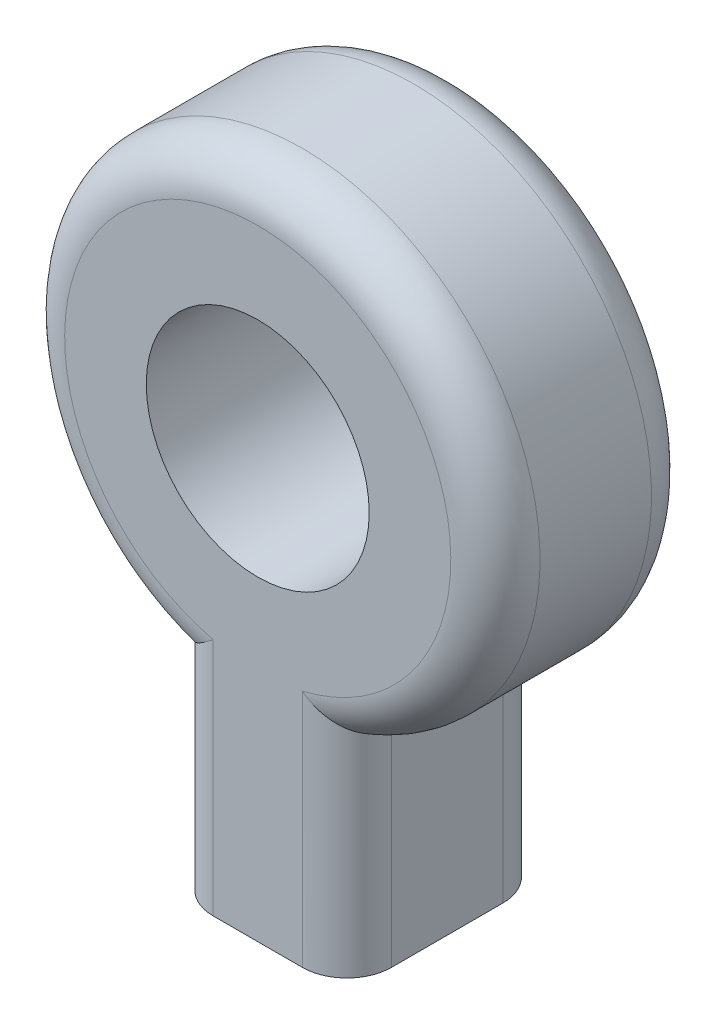
from build123d import *

# Parameters (mm, degrees)
SKETCH1_R           = 5
BOSS_EXTRUDE1_DEPTH = 9
FILLET1_R           = 2
SKETCH2_R           = 3
CUT_EXTRUDE2_DEPTH  = 9


with BuildPart() as part:
    # Sketch1 → Boss-Extrude1 (new body)
    with BuildSketch(Plane.XY):
        with BuildLine():
            Line((-3.996251998, 18.882233703), (-3.996251998, 9.603351185))
            Line((-3.996251998, 9.603351185), (0, 9.603351185))
            Line((0, 9.603351185), (4, 9.603351185))
            Line((4, 9.603351185), (4, 18.883750084))
            ThreePointArc((4, 18.883750084), (-0.002021567, 39.425278988), (-3.996251998, 18.882233703))
        make_face()
        with Locations((0, 28.765059691)):
            Circle(SKETCH1_R, mode=Mode.SUBTRACT)
    extrude(amount=BOSS_EXTRUDE1_DEPTH)

    # Fillet1
    fillet1_edges = [part.edges().sort_by_distance(p)[0] for p in [
        (-0.002021567, 39.425278988, 9),
        (-3.996251998, 14.242792444, 9),
        (-3.996251998, 14.242792444, 0),
        (-0.002021567, 39.425278988, 0),
        (4, 14.243550634, 0),
        (4, 14.243550634, 9),
    ]]
    fillet(fillet1_edges, radius=FILLET1_R)

    # Sketch2 → Cut-Extrude2 (cut)
    with BuildSketch(Plane.XZ.offset(-9.603351185)):
        with Locations(Location((0, 4.569140721, 0), (0, 0, 270))):
            Circle(SKETCH2_R)
    extrude(amount=-CUT_EXTRUDE2_DEPTH, mode=Mode.SUBTRACT)


solid = part.part
